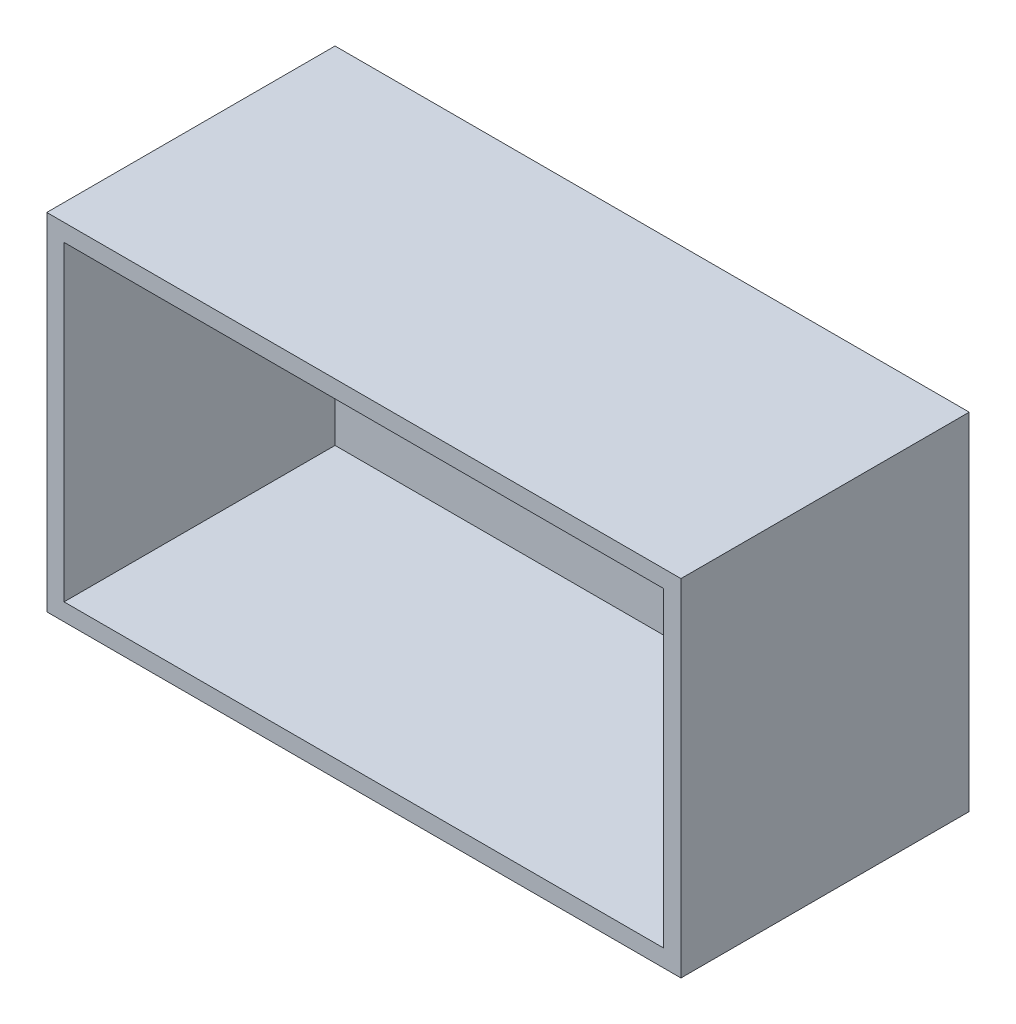
from build123d import *

# Parameters (mm, degrees)
SKETCH_1_W        = 110
SKETCH_1_H        = 60
EXTRUDE_2_DEPTH   = 3
SKETCH_2_W        = 110
SKETCH_2_H        = 60
SKETCH_2_W_2      = 104
SKETCH_2_H_2      = 54
EXTRUDE_2_2_DEPTH = 47


with BuildPart() as part:
    # 스케치1 → Extrude 2 (new body)
    with BuildSketch(Plane.XY):
        Rectangle(SKETCH_1_W, SKETCH_1_H)
    extrude(amount=EXTRUDE_2_DEPTH)

    # 스케치2 → Extrude 2 2 (add)
    with BuildSketch(Plane.XY.offset(3)):
        Rectangle(SKETCH_2_W, SKETCH_2_H)
        Rectangle(SKETCH_2_W_2, SKETCH_2_H_2, mode=Mode.SUBTRACT)
    extrude(amount=EXTRUDE_2_2_DEPTH)


solid = part.part
